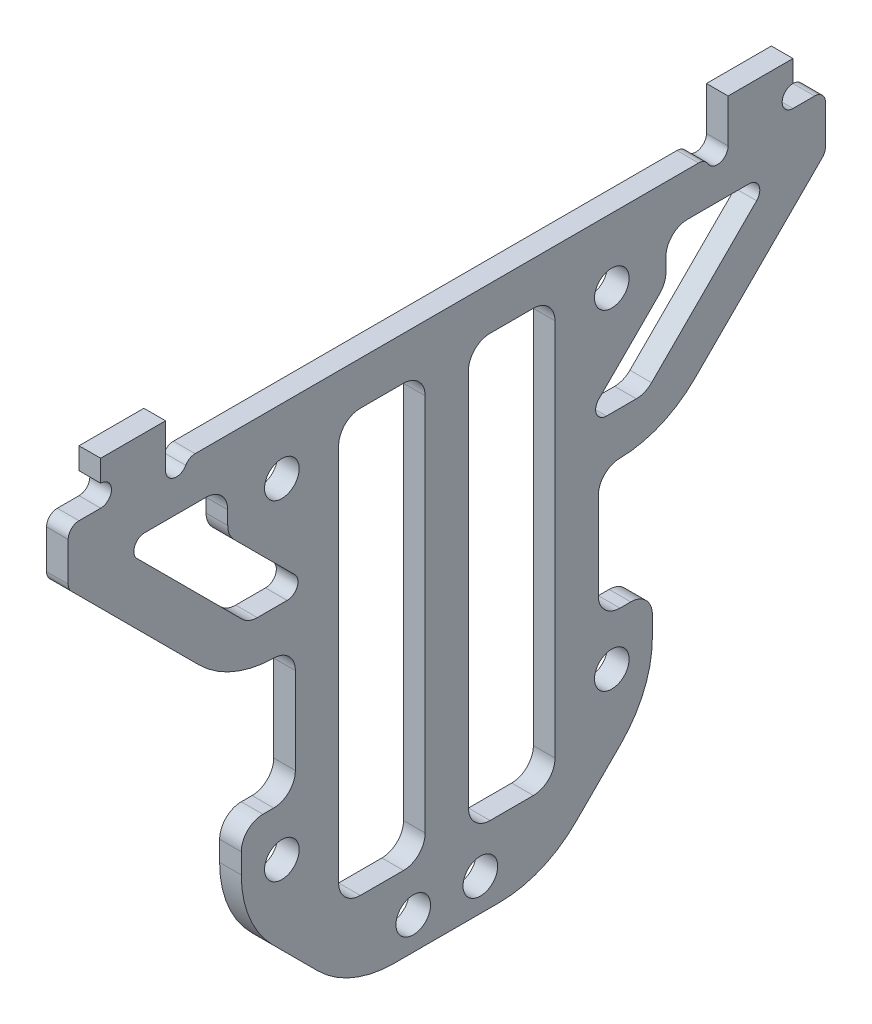
from build123d import *

# Parameters (mm, degrees)
EXTRUDE_1_DEPTH        = 2
HOLE_WIZARD_M3_1_D     = 3.2
HOLE_WIZARD_M3_2_D     = 3.2
CHAMFER_1_SIZE         = 15
FILLET_1_R             = 2
CHAMFER_2_SIZE         = 10
SKETCH_6_W             = 8
SKETCH_6_H             = 39
CUT_EXTRUDE_1_DEPTH    = 100
FILLET_2_R             = 1
FILLET_3_R             = 2
FILLET_2_OF_MIRROR_2_R = 1
FILLET_3_OF_MIRROR_2_R = 2
SKETCH_8_R             = 1
CUT_EXTRUDE_2_DEPTH    = 10
FILLET_4_R             = 1
FILLET_5_R             = 10
FILLET_6_R             = 1


with BuildPart() as part:
    # 草图1 → 凸台-拉伸1 (new body)
    with BuildSketch(Plane(origin=(0, 0, 0), x_dir=(0, 0, -1), z_dir=(1, 0, 0))):
        Polygon((0, 50), (26, 50), (26, 54), (32, 54), (32, 50), (35, 50), (35, 30), (14, 30), (14, 18), (19, 18), (19, 0), (0, 0), align=None)
    extrude_1 = extrude(amount=EXTRUDE_1_DEPTH)

    # 镜向1: 凸台-拉伸1 across plane
    add(extrude_1.mirror(Plane(origin=(2, 0, 0), x_dir=(1, 0, 0), z_dir=(0, 0, -1))))

    # M3 间隙孔1 (through all)
    with Locations(Plane(origin=(2, 0, 0), x_dir=(0, 0, -1), z_dir=(1, 0, 0))):
        with Locations((-15.25, 44), (-15.25, 13.5), (15.25, 13.5), (15.25, 44)):
            Hole(HOLE_WIZARD_M3_1_D / 2)

    # M3 间隙孔2 (through all)
    with Locations(Plane(origin=(2, 0, 0), x_dir=(0, 0, -1), z_dir=(1, 0, 0))):
        with Locations((-3.1, 3), (3.1, 3)):
            Hole(HOLE_WIZARD_M3_2_D / 2)

    # 倒角1
    chamfer_1_edges = [part.edges().sort_by_distance(p)[0] for p in [
        (1, 30, -35),
        (1, 30, 35),
    ]]
    chamfer(chamfer_1_edges, length=CHAMFER_1_SIZE)

    # 圆角1
    fillet_1_edges = [part.edges().sort_by_distance(p)[0] for p in [
        (1, 30, -14),
        (1, 18, -14),
        (1, 18, -19),
        (1, 30, 14),
        (1, 18, 14),
        (1, 18, 19),
    ]]
    fillet(fillet_1_edges, radius=FILLET_1_R)

    # 倒角2
    chamfer_2_edges = [part.edges().sort_by_distance(p)[0] for p in [
        (1, 0, -19),
        (1, 0, 19),
    ]]
    chamfer(chamfer_2_edges, length=CHAMFER_2_SIZE)

    # 草图6 → 切除-拉伸1 (cut)
    with BuildSketch(Plane(origin=(2, 0, 0), x_dir=(0, 0, -1), z_dir=(1, 0, 0))):
        with Locations((-6, 26.5)):
            Rectangle(SKETCH_6_W, SKETCH_6_H)
        Polygon((-30.343145751, 46), (-18.343145751, 34), (-12.343145751, 34), (-20.25, 41.906854249), (-20.25, 46), (-24.343145751, 46), align=None)
    cut_extrude_1 = extrude(amount=-CUT_EXTRUDE_1_DEPTH, mode=Mode.SUBTRACT)

    # 圆角2
    fillet_2_edges = [part.edges().sort_by_distance(p)[0] for p in [
        (1, 46, 30.343145751),
        (1, 34, 12.343145751),
    ]]
    fillet(fillet_2_edges, radius=FILLET_2_R)

    # 圆角3
    fillet_3_edges = [part.edges().sort_by_distance(p)[0] for p in [
        (1, 7, 10),
        (1, 46, 10),
        (1, 46, 2),
        (1, 7, 2),
        (1, 46, 20.25),
        (1, 41.906854249, 20.25),
        (1, 34, 18.343145751),
    ]]
    fillet(fillet_3_edges, radius=FILLET_3_R)

    # 镜向2: 切除-拉伸1 across plane
    add(cut_extrude_1.mirror(Plane.XY), mode=Mode.SUBTRACT)

    # 圆角2 of 镜向2
    fillet_2_of_mirror_2_edges = [part.edges().sort_by_distance(p)[0] for p in [
        (1, 46, -30.343145751),
        (1, 34, -12.343145751),
    ]]
    fillet(fillet_2_of_mirror_2_edges, radius=FILLET_2_OF_MIRROR_2_R)

    # 圆角3 of 镜向2
    fillet_3_of_mirror_2_edges = [part.edges().sort_by_distance(p)[0] for p in [
        (1, 7, -10),
        (1, 46, -10),
        (1, 46, -2),
        (1, 7, -2),
        (1, 46, -20.25),
        (1, 41.906854249, -20.25),
        (1, 34, -18.343145751),
    ]]
    fillet(fillet_3_of_mirror_2_edges, radius=FILLET_3_OF_MIRROR_2_R)

    # 草图8 → 切除-拉伸2 (cut)
    with BuildSketch(Plane(origin=(2, 0, 0), x_dir=(0, 0, -1), z_dir=(1, 0, 0))):
        with Locations((-25, 50)):
            Circle(SKETCH_8_R)
        with Locations((-32, 51)):
            Circle(SKETCH_8_R)
        with Locations((32, 51)):
            Circle(SKETCH_8_R)
        with Locations((25, 50)):
            Circle(SKETCH_8_R)
    extrude(amount=-CUT_EXTRUDE_2_DEPTH, mode=Mode.SUBTRACT)

    # 圆角4
    fillet_4_edges = [part.edges().sort_by_distance(p)[0] for p in [
        (1, 50, -24),
        (1, 50, 24),
    ]]
    fillet(fillet_4_edges, radius=FILLET_4_R)

    # 圆角5
    fillet_5_edges = [part.edges().sort_by_distance(p)[0] for p in [
        (1, 30, -20),
        (1, 10, -19),
        (1, 0, -9),
        (1, 30, 20),
        (1, 10, 19),
        (1, 0, 9),
    ]]
    fillet(fillet_5_edges, radius=FILLET_5_R)

    # 圆角6
    fillet_6_edges = [part.edges().sort_by_distance(p)[0] for p in [
        (1, 45, 35),
        (1, 50, -35),
        (1, 50, 35),
        (1, 45, -35),
    ]]
    fillet(fillet_6_edges, radius=FILLET_6_R)


solid = part.part
